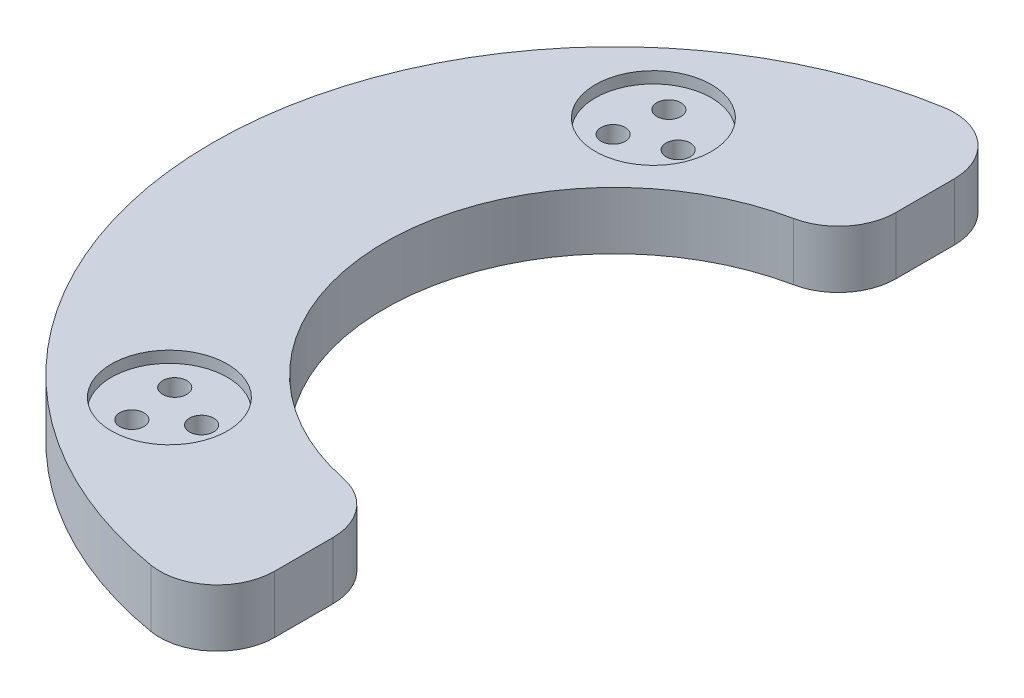
from build123d import *

# Parameters (mm, degrees)
SKETCH_1_R          = 70
SKETCH_1_R_2        = 40
EXTRUDE_1_DEPTH     = 10
SKETCH_2_W          = 120.331390639
SKETCH_2_H          = 328.028138093
CUT_EXTRUDE_1_DEPTH = 62
SKETCH_3_R          = 10.1
CUT_EXTRUDE_2_DEPTH = 2
FILLET_1_R          = 10
SKETCH_4_R          = 2.1
CUT_EXTRUDE_3_DEPTH = 10


with BuildPart() as part:
    # 草图1 → 凸台-拉伸1 (new body)
    with BuildSketch(Plane(origin=(0, 0, 0), x_dir=(1, 0, 0), z_dir=(0, 1, 0))):
        with Locations(Location((0, 0, 0), (0, 0, 270))):
            Circle(SKETCH_1_R)
        with Locations(Location((0, 0, 0), (0, 0, 270))):
            Circle(SKETCH_1_R_2, mode=Mode.SUBTRACT)
    extrude(amount=EXTRUDE_1_DEPTH)

    # 草图2 → 切除-拉伸1 (cut)
    with BuildSketch(Plane(origin=(0, 10, 0), x_dir=(1, 0, 0), z_dir=(0, 1, 0))):
        with Locations((60.16569532, 8.487402818)):
            Rectangle(SKETCH_2_W, SKETCH_2_H)
    extrude(amount=-CUT_EXTRUDE_1_DEPTH, mode=Mode.SUBTRACT)

    # 草图3 → 切除-拉伸2 (cut)
    with BuildSketch(Plane(origin=(0, 10, 0), x_dir=(1, 0, 0), z_dir=(0, 1, 0))):
        with Locations(Location((-35.353318533, -42.132444372, 0), (0, 0, 270))):
            Circle(SKETCH_3_R)
    cut_extrude_2 = extrude(amount=-CUT_EXTRUDE_2_DEPTH, mode=Mode.SUBTRACT)

    # 镜向1: 切除-拉伸2 across plane
    add(cut_extrude_2.mirror(Plane.XY), mode=Mode.SUBTRACT)

    # 圆角1
    fillet_1_edges = [part.edges().sort_by_distance(p)[0] for p in [
        (0, 5, 40),
        (0, 5, -40),
        (0, 5, -70),
        (0, 5, 70),
    ]]
    fillet(fillet_1_edges, radius=FILLET_1_R)

    # 草图4 → 切除-拉伸3 (cut)
    with BuildSketch(Plane(origin=(0, 8, 0), x_dir=(1, 0, 0), z_dir=(0, 1, 0))):
        with Locations(Location((-38.391050289, -38.161023243, 0), (0, 0, 270))):
            Circle(SKETCH_4_R)
        with Locations(Location((-30.395101069, -41.487402065, 0), (0, 0, 270))):
            Circle(SKETCH_4_R)
        with Locations(Location((-37.273804241, -46.748907806, 0), (0, 0, 270))):
            Circle(SKETCH_4_R)
    cut_extrude_3 = extrude(amount=-CUT_EXTRUDE_3_DEPTH, mode=Mode.SUBTRACT)

    # 镜向2: 切除-拉伸3 across plane
    add(cut_extrude_3.mirror(Plane.XY), mode=Mode.SUBTRACT)


solid = part.part
